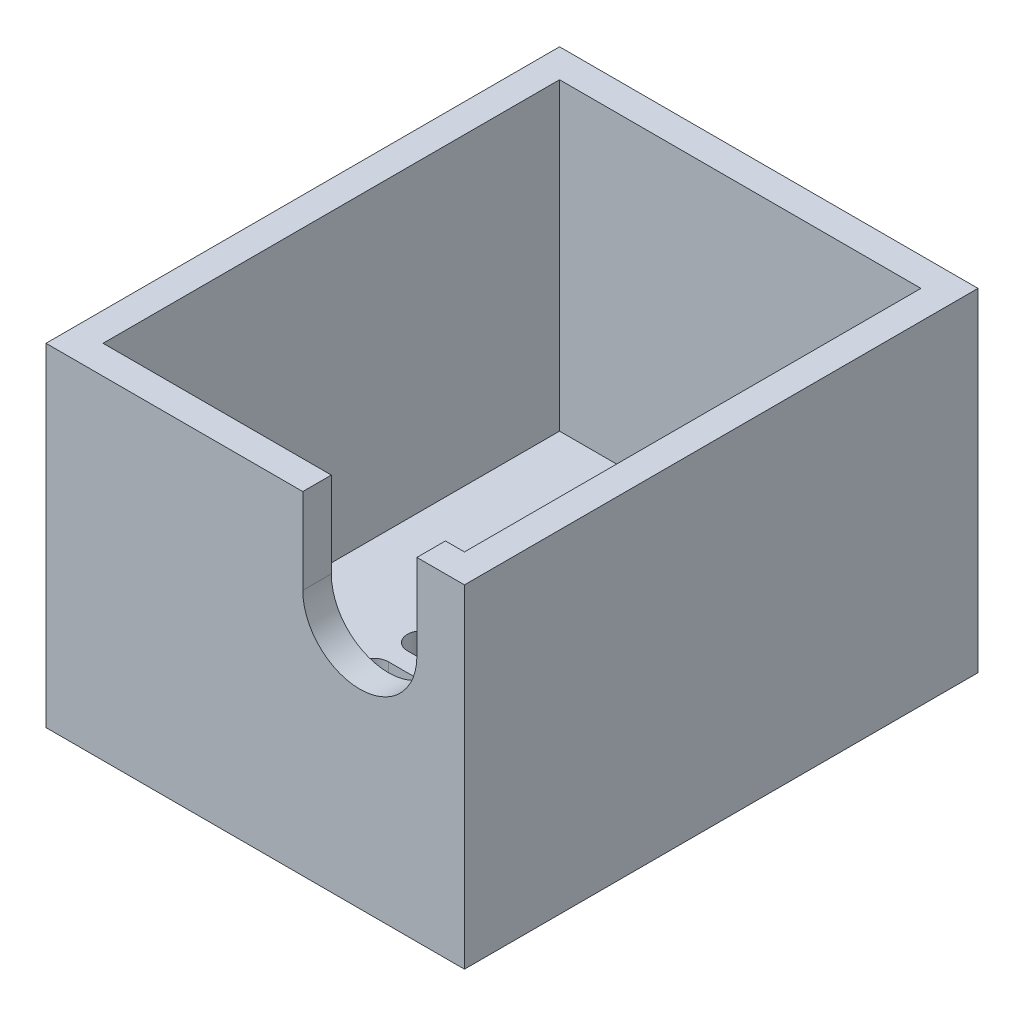
from build123d import *

# Parameters (mm, degrees)
SCHIZZO1_W                   = 44
SCHIZZO1_H                   = 54
ESTRUSIONE_ESTRUSIONE1_DEPTH = 35
SVUOTA1_T                    = -3
TAGLIO_ESTRUSIONE1_DEPTH     = 57.871813174
TAGLIO_ESTRUSIONE2_REACH     = 72.714


with BuildPart() as part:
    # Schizzo1 → Estrusione-Estrusione1 (new body)
    with BuildSketch(Plane(origin=(0, 0, 0), x_dir=(1, 0, 0), z_dir=(0, 1, 0))):
        with Locations((-7.317535287, -9.754391008)):
            Rectangle(SCHIZZO1_W, SCHIZZO1_H)
    extrude(amount=ESTRUSIONE_ESTRUSIONE1_DEPTH)

    # Svuota1
    svuota1_openings = [part.faces().sort_by_distance(p)[0] for p in [
        (-7.317535287, 35, 9.754391008),
    ]]
    offset(amount=SVUOTA1_T, openings=svuota1_openings, kind=Kind.INTERSECTION)

    # Schizzo2 → Taglio-Estrusione1 (cut, through all)
    with BuildSketch(Plane(origin=(0, 3, 0), x_dir=(1, 0, 0), z_dir=(0, 1, 0))):
        with BuildLine():
            Line((-0.317535287, -0.754391008), (-14.317535287, -0.754391008))
            ThreePointArc((-14.317535287, -0.754391008), (-15.817535287, -2.254391008), (-14.317535287, -3.754391008))
            Line((-14.317535287, -3.754391008), (-0.317535287, -3.754391008))
            ThreePointArc((-0.317535287, -3.754391008), (1.182464713, -2.254391008), (-0.317535287, -0.754391008))
        make_face()
        with BuildLine():
            Line((-0.317535287, -5.754391008), (-14.317535287, -5.754391008))
            ThreePointArc((-14.317535287, -5.754391008), (-15.817535287, -7.254391008), (-14.317535287, -8.754391008))
            Line((-14.317535287, -8.754391008), (-0.317535287, -8.754391008))
            ThreePointArc((-0.317535287, -8.754391008), (1.182464713, -7.254391008), (-0.317535287, -5.754391008))
        make_face()
        with BuildLine():
            Line((-0.317535287, -10.754391008), (-14.317535287, -10.754391008))
            ThreePointArc((-14.317535287, -10.754391008), (-15.817535287, -12.254391008), (-14.317535287, -13.754391008))
            Line((-14.317535287, -13.754391008), (-0.317535287, -13.754391008))
            ThreePointArc((-0.317535287, -13.754391008), (1.182464713, -12.254391008), (-0.317535287, -10.754391008))
        make_face()
        with BuildLine():
            Line((-0.317535287, -15.754391008), (-14.317535287, -15.754391008))
            ThreePointArc((-14.317535287, -15.754391008), (-15.817535287, -17.254391008), (-14.317535287, -18.754391008))
            Line((-14.317535287, -18.754391008), (-0.317535287, -18.754391008))
            ThreePointArc((-0.317535287, -18.754391008), (1.182464713, -17.254391008), (-0.317535287, -15.754391008))
        make_face()
    extrude(amount=-TAGLIO_ESTRUSIONE1_DEPTH, mode=Mode.SUBTRACT)

    # Schizzo3 → Taglio-Estrusione2 (cut, up to next)
    with BuildSketch(Plane.XY.offset(36.754391008), mode=Mode.PRIVATE) as taglio_estrusione2_sk1:
        with BuildLine():
            Line((9.682464713, 35), (9.682464713, 26))
            ThreePointArc((9.682464713, 26), (3.682464713, 20), (-2.317535287, 26))
            Line((-2.317535287, 26), (-2.317535287, 35))
            Line((-2.317535287, 35), (9.682464713, 35))
        make_face()
    taglio_estrusione2_tool1 = extrude(taglio_estrusione2_sk1.sketch, amount=-TAGLIO_ESTRUSIONE2_REACH, mode=Mode.PRIVATE) & part.part
    add(taglio_estrusione2_tool1.solids().sort_by_distance((3.682465, 28.078412, 36.754391))[0], mode=Mode.SUBTRACT)


solid = part.part
